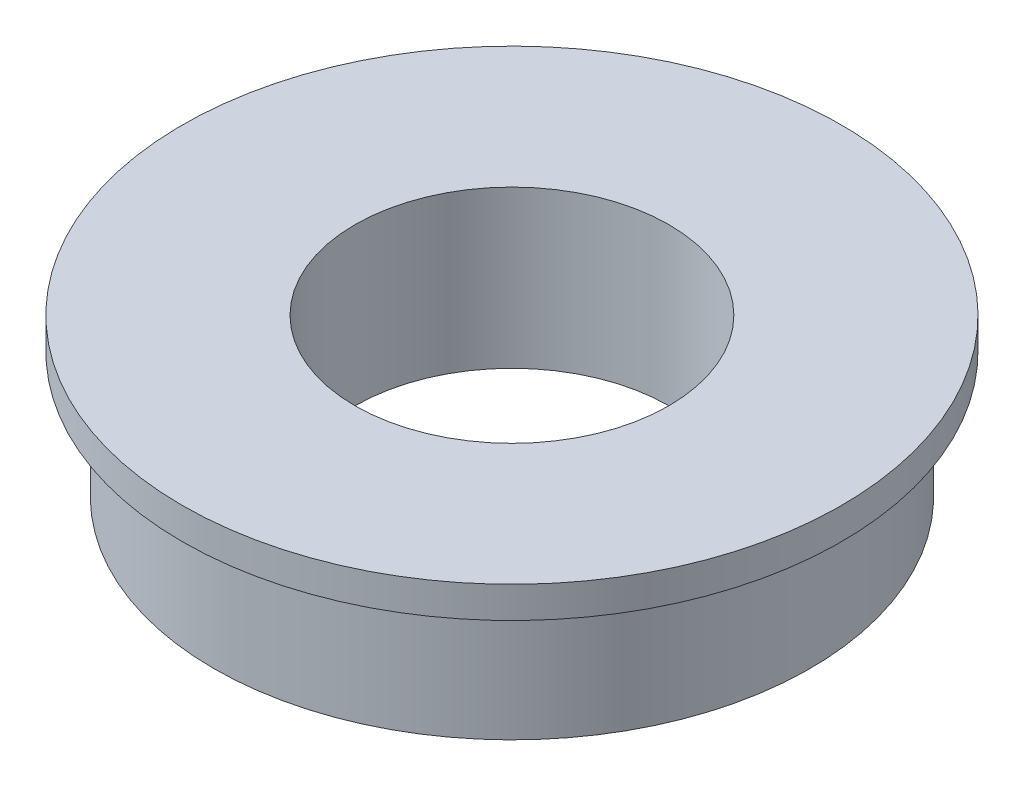
from build123d import *


with BuildPart() as part:
    # Sketch1 → Revolve1 (revolve)
    with BuildSketch(Plane(origin=(0, 0, 0), x_dir=(0, 0, -1), z_dir=(1, 0, 0)), mode=Mode.PRIVATE) as revolve1_sk:
        Polygon((5, 0), (10.5, 0), (10.5, -1), (9.5, -1), (9.5, -5), (5, -5), align=None)
    revolve(revolve1_sk.sketch.rotate(Axis((0, 15.062939032, 0), (0, -1, 0)), 180), axis=Axis((0, 15.062939032, 0), (0, -1, 0)))


solid = part.part
